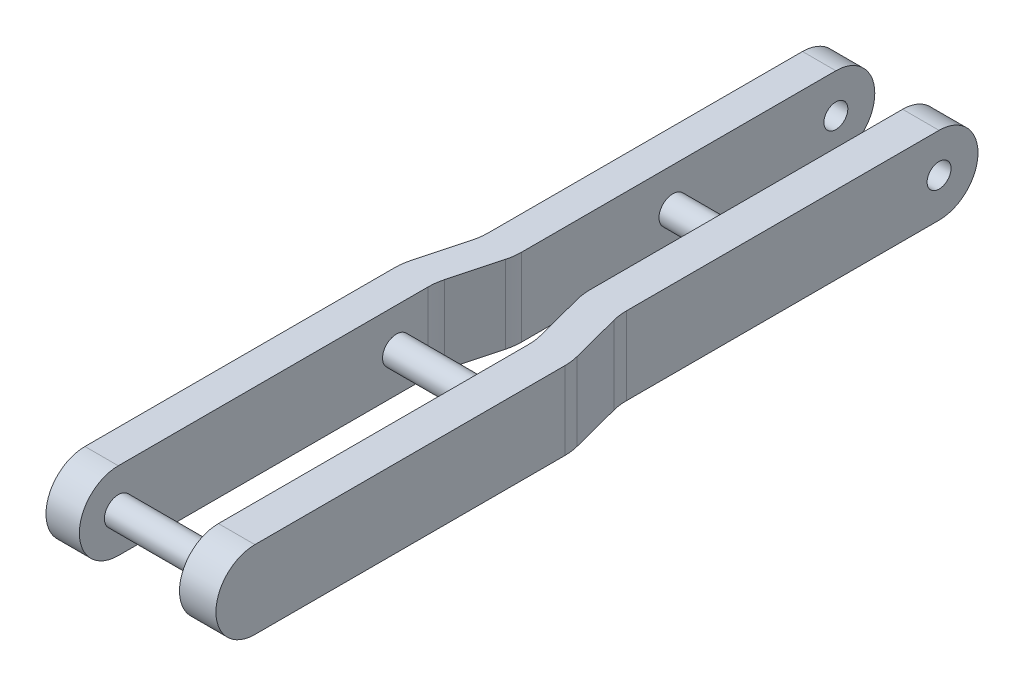
from build123d import *

# Parameters (mm, degrees)
EXTRUDE_2_DEPTH     = 14
FILLET_1_RADIUS     = 7
FILLET_1_LENGTH     = 6.553419282
FILLET_2_RADIUS     = 7
FILLET_2_LENGTH     = 6.553419282
CUT_EXTRUDE_1_REACH = 142.851
SKETCH_2_R          = 2.15
EXTRUDE_3_DEPTH     = 14
FILLET_3_RADIUS     = 7
FILLET_3_LENGTH     = 6
FILLET_4_RADIUS     = 7
FILLET_4_LENGTH     = 6
EXTRUDE_5_REACH     = 144.825
SKETCH_8_R          = 2.5
CUT_EXTRUDE_5_REACH = 145.371
SKETCH_10_R         = 2.15
EXTRUDE_6_REACH     = 144.34
SKETCH_11_R         = 2.5


with BuildPart() as part:
    # 草图1 → 凸台-拉伸2 (new body)
    with BuildSketch(Plane(origin=(0, 0, 0), x_dir=(1, 0, 0), z_dir=(0, 1, 0))):
        with BuildLine():
            Line((5, 0), (5, 62.718048915))
            ThreePointArc((5, 62.718048915), (4.918829182, 63.989594298), (4.676634468, 65.240497206))
            Line((4.676634468, 65.240497206), (2.323365532, 74.268124597))
            ThreePointArc((2.323365532, 74.268124597), (2.081170818, 75.519027505), (2, 76.790572889))
            Line((2, 76.790572889), (2, 140))
            Line((2, 140), (-4.553419282, 140))
            Line((-4.553419282, 140), (-4.553419282, 76.790572889))
            ThreePointArc((-4.553419282, 76.790572889), (-4.472248464, 75.519027505), (-4.23005375, 74.268124597))
            Line((-4.23005375, 74.268124597), (-1.876784815, 65.240497206))
            ThreePointArc((-1.876784815, 65.240497206), (-1.6345901, 63.989594298), (-1.553419282, 62.718048915))
            Line((-1.553419282, 62.718048915), (-1.553419282, 0))
            Line((-1.553419282, 0), (5, 0))
        make_face()
    extrude(amount=EXTRUDE_2_DEPTH)

    # 圆角1: full round fillet: the end face becomes a half cylinder, R = half its width
    fillet_1_face = Plane((1.723290359, 7, 0), x_dir=(1, 0, 0), z_dir=(0, 0, 1))  # on the end face: x along it, z out of the body
    fillet_1_slab = fillet_1_face.offset(-FILLET_1_RADIUS / 2) * Box(FILLET_1_LENGTH, 2 * FILLET_1_RADIUS, FILLET_1_RADIUS, mode=Mode.PRIVATE)  # the body's end, R deep
    fillet_1_round = Plane((1.723290359, 7, -7), x_dir=(0, 0, 1), z_dir=(1, 0, 0)) * Cylinder(FILLET_1_RADIUS, FILLET_1_LENGTH, mode=Mode.PRIVATE)  # its axis R under the face
    add(fillet_1_slab - fillet_1_round, mode=Mode.SUBTRACT)

    # 圆角2: full round fillet: the end face becomes a half cylinder, R = half its width
    fillet_2_face = Plane((-1.276709641, 7, -140), x_dir=(-1, 0, 0), z_dir=(0, 0, -1))  # on the end face: x along it, z out of the body
    fillet_2_slab = fillet_2_face.offset(-FILLET_2_RADIUS / 2) * Box(FILLET_2_LENGTH, 2 * FILLET_2_RADIUS, FILLET_2_RADIUS, mode=Mode.PRIVATE)  # the body's end, R deep
    fillet_2_round = Plane((-1.276709641, 7, -133), x_dir=(0, 0, -1), z_dir=(-1, 0, 0)) * Cylinder(FILLET_2_RADIUS, FILLET_2_LENGTH, mode=Mode.PRIVATE)  # its axis R under the face
    add(fillet_2_slab - fillet_2_round, mode=Mode.SUBTRACT)

    # 草图2 → 切除-拉伸1 (cut, up to next)
    with BuildSketch(Plane(origin=(2, 0, 0), x_dir=(0, 0, -1), z_dir=(1, 0, 0)), mode=Mode.PRIVATE) as cut_extrude_1_sk1:
        with Locations((133, 7)):
            Circle(SKETCH_2_R)
    cut_extrude_1_tool1 = extrude(cut_extrude_1_sk1.sketch, amount=-CUT_EXTRUDE_1_REACH, mode=Mode.PRIVATE) & part.part
    add(cut_extrude_1_tool1.solids().sort_by_distance((2, 7, -133))[0], mode=Mode.SUBTRACT)

    # 草图8 → 凸台-拉伸5 (add, up to next)
    with BuildSketch(Plane(origin=(-19.553419282, 0, 0), x_dir=(0, 0, -1), z_dir=(1, 0, 0)), mode=Mode.PRIVATE) as extrude_5_sk1:
        with Locations(Location((7, 7, 0), (0, 0, 180))):
            Circle(SKETCH_8_R)
    extrude_5_tool1 = extrude(extrude_5_sk1.sketch, amount=EXTRUDE_5_REACH, mode=Mode.PRIVATE) - part.part
    # 草图8 → 凸台-拉伸5 (add, up to next)
    with BuildSketch(Plane(origin=(-19.553419282, 0, 0), x_dir=(0, 0, -1), z_dir=(1, 0, 0)), mode=Mode.PRIVATE) as extrude_5_sk2:
        with Locations(Location((57, 7, 0), (0, 0, 180))):
            Circle(SKETCH_8_R)
    extrude_5_tool2 = extrude(extrude_5_sk2.sketch, amount=EXTRUDE_5_REACH, mode=Mode.PRIVATE) - part.part


with BuildPart() as body_2:
    # 草图4 → 凸台-拉伸3 (new body)
    with BuildSketch(Plane(origin=(0, 0, 0), x_dir=(1, 0, 0), z_dir=(0, 1, 0))):
        with BuildLine():
            Line((-19.553419282, 0), (-25.553419282, 0))
            Line((-25.553419282, 0), (-25.553419282, 62.683862831))
            ThreePointArc((-25.553419282, 62.683862831), (-25.467917646, 63.988746812), (-25.212874842, 65.271316849))
            Line((-25.212874842, 65.271316849), (-22.893963723, 73.928250938))
            ThreePointArc((-22.893963723, 73.928250938), (-22.638920919, 75.210820976), (-22.553419282, 76.515704957))
            Line((-22.553419282, 76.515704957), (-22.553419282, 140))
            Line((-22.553419282, 140), (-16.553419282, 140))
            Line((-16.553419282, 140), (-16.553419282, 76.515704957))
            ThreePointArc((-16.553419282, 76.515704957), (-16.638920919, 75.210820976), (-16.893963723, 73.928250938))
            Line((-16.893963723, 73.928250938), (-19.212874842, 65.271316849))
            ThreePointArc((-19.212874842, 65.271316849), (-19.467917646, 63.988746812), (-19.553419282, 62.683862831))
            Line((-19.553419282, 62.683862831), (-19.553419282, 0))
        make_face()
    extrude(amount=EXTRUDE_3_DEPTH)

    # 圆角3: full round fillet: the end face becomes a half cylinder, R = half its width
    fillet_3_face = Plane((-19.553419282, 7, -140), x_dir=(-1, 0, 0), z_dir=(0, 0, -1))  # on the end face: x along it, z out of the body
    fillet_3_slab = fillet_3_face.offset(-FILLET_3_RADIUS / 2) * Box(FILLET_3_LENGTH, 2 * FILLET_3_RADIUS, FILLET_3_RADIUS, mode=Mode.PRIVATE)  # the body's end, R deep
    fillet_3_round = Plane((-19.553419282, 7, -133), x_dir=(0, 0, -1), z_dir=(-1, 0, 0)) * Cylinder(FILLET_3_RADIUS, FILLET_3_LENGTH, mode=Mode.PRIVATE)  # its axis R under the face
    add(fillet_3_slab - fillet_3_round, mode=Mode.SUBTRACT)

    # 圆角4: full round fillet: the end face becomes a half cylinder, R = half its width
    fillet_4_face = Plane((-22.553419282, 7, 0), x_dir=(1, 0, 0), z_dir=(0, 0, 1))  # on the end face: x along it, z out of the body
    fillet_4_slab = fillet_4_face.offset(-FILLET_4_RADIUS / 2) * Box(FILLET_4_LENGTH, 2 * FILLET_4_RADIUS, FILLET_4_RADIUS, mode=Mode.PRIVATE)  # the body's end, R deep
    fillet_4_round = Plane((-22.553419282, 7, -7), x_dir=(0, 0, 1), z_dir=(1, 0, 0)) * Cylinder(FILLET_4_RADIUS, FILLET_4_LENGTH, mode=Mode.PRIVATE)  # its axis R under the face
    add(fillet_4_slab - fillet_4_round, mode=Mode.SUBTRACT)


with BuildPart() as part_1:
    add(part.part)

    add(body_2.part)  # 凸台-拉伸5 merges body 2
    add(extrude_5_tool1.solids().sort_by_distance((-19.553419, 7, -7))[0])
    add(extrude_5_tool2.solids().sort_by_distance((-19.553419, 7, -57))[0])

    # 草图10 → 切除-拉伸5 (cut, up to next)
    with BuildSketch(Plane.ZY.offset(22.553419282), mode=Mode.PRIVATE) as cut_extrude_5_sk1:
        with Locations(Location((-133, 7, 0), (0, 0, 180))):
            Circle(SKETCH_10_R)
    cut_extrude_5_tool1 = extrude(cut_extrude_5_sk1.sketch, amount=-CUT_EXTRUDE_5_REACH, mode=Mode.PRIVATE) & part_1.part
    add(cut_extrude_5_tool1.solids().sort_by_distance((-22.553419, 7, -133))[0], mode=Mode.SUBTRACT)

    # 草图11 → 凸台-拉伸6 (add, up to next)
    with BuildSketch(Plane(origin=(-16.553419282, 0, 0), x_dir=(0, 0, -1), z_dir=(1, 0, 0)), mode=Mode.PRIVATE) as extrude_6_sk1:
        with Locations(Location((103.7, 7, 0), (0, 0, 180))):
            Circle(SKETCH_11_R)
    extrude_6_tool1 = extrude(extrude_6_sk1.sketch, amount=EXTRUDE_6_REACH, mode=Mode.PRIVATE) - part_1.part
    add(extrude_6_tool1.solids().sort_by_distance((-16.553419, 7, -103.7))[0])


solid = part_1.part
